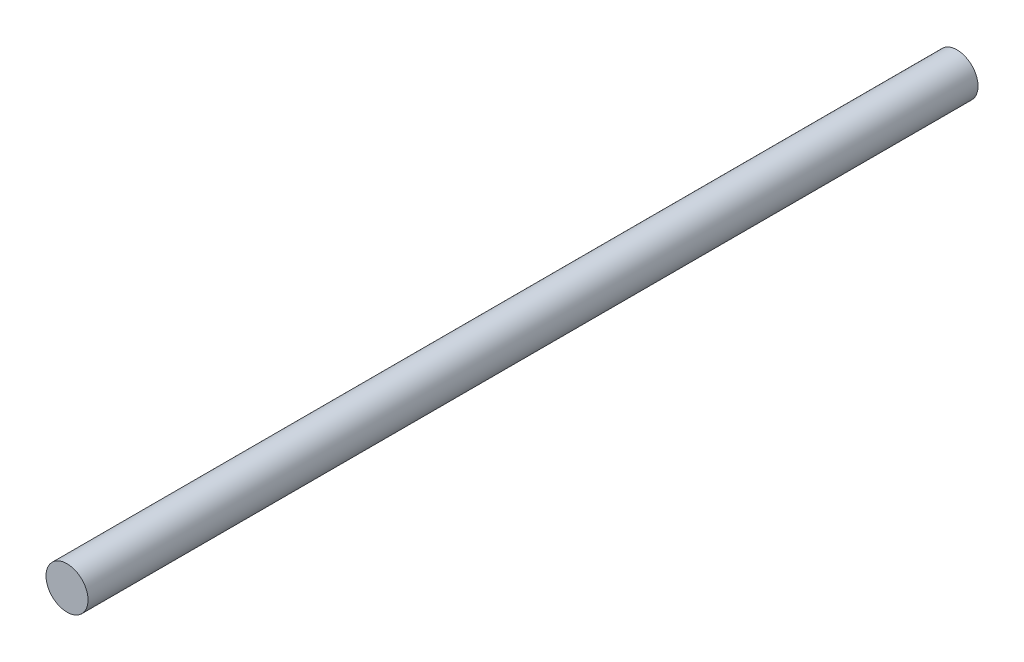
from build123d import *

# Parameters (mm, degrees)
SKETCH1_R           = 8.5
BOSS_EXTRUDE1_DEPTH = 360


with BuildPart() as part:
    # Sketch1 → Boss-Extrude1 (new body)
    with BuildSketch(Plane.XY):
        with Locations(Location((0, 0, 0), (0, 0, 180))):
            Circle(SKETCH1_R)
    extrude(amount=BOSS_EXTRUDE1_DEPTH)


solid = part.part
